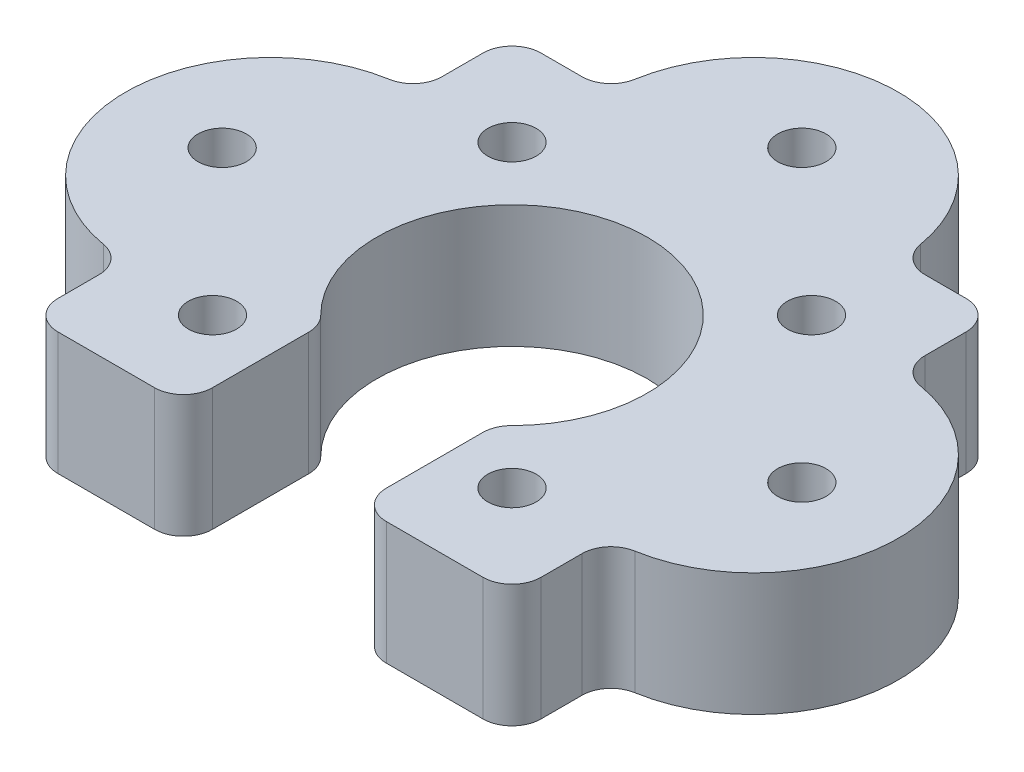
from build123d import *

# Parameters (mm, degrees)
BOSS_EXTRUDE1_DEPTH         = 12.7
TAP_DRILL_FOR_M6X1_0_TAP1_D = 5
FILLET1_R                   = 3


with BuildPart() as part:
    # Sketch1 → Boss-Extrude1 (new body)
    with BuildSketch(Plane(origin=(0, 0, 0), x_dir=(1, 0, 0), z_dir=(0, 1, 0))):
        with BuildLine():
            Line((-25, -15), (-25, -25))
            Line((-25, -25), (-9, -25))
            Line((-9, -25), (-9, -10.723805295))
            ThreePointArc((-9, -10.723805295), (0, 14), (9, -10.723805295))
            Line((9, -10.723805295), (9, -25))
            Line((9, -25), (25, -25))
            Line((25, -25), (25, -15))
            ThreePointArc((25, -15), (40, 0), (25, 15))
            Line((25, 15), (25, 25))
            Line((25, 25), (15, 25))
            ThreePointArc((15, 25), (0, 40), (-15, 25))
            Line((-15, 25), (-25, 25))
            Line((-25, 25), (-25, 15))
            ThreePointArc((-25, 15), (-40, 0), (-25, -15))
        make_face()
    extrude(amount=-BOSS_EXTRUDE1_DEPTH)

    # Tap Drill for M6x1.0 Tap1 (through all)
    with Locations(Plane(origin=(-15.5, 0, 15.5), x_dir=(0, 0, 1), z_dir=(0, 1, 0))):
        with Locations((0, 0), (-31, 0), (-31, 31), (0, 31), (-15.5, -14.5), (-45.5, 15.5), (-15.5, 45.5)):
            Hole(TAP_DRILL_FOR_M6X1_0_TAP1_D / 2)

    # Fillet1
    fillet1_edges = [part.edges().sort_by_distance(p)[0] for p in [
        (-25, -6.35, -15),
        (-25, -6.35, -25),
        (-15, -6.35, -25),
        (15, -6.35, -25),
        (25, -6.35, -25),
        (25, -6.35, -15),
        (25, -6.35, 15),
        (25, -6.35, 25),
        (9, -6.35, 25),
        (9, -6.35, 10.723805295),
        (-9, -6.35, 10.723805295),
        (-9, -6.35, 25),
        (-25, -6.35, 25),
        (-25, -6.35, 15),
    ]]
    fillet(fillet1_edges, radius=FILLET1_R)


solid = part.part
